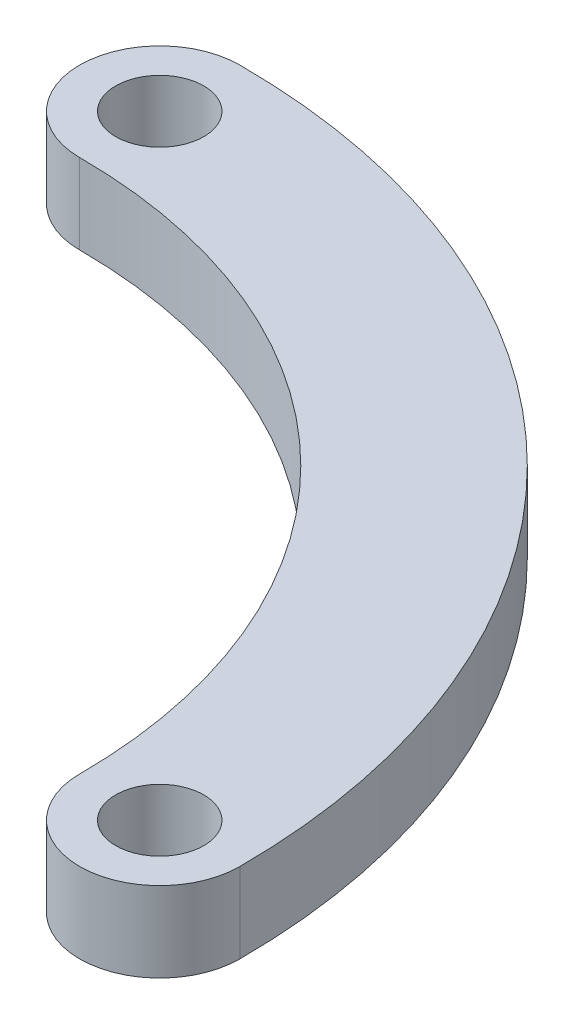
from build123d import *

# Parameters (mm, degrees)
SKETCH_1_R      = 1.65
EXTRUDE_2_DEPTH = 3


with BuildPart() as part:
    # 草图1 → 凸台-拉伸2 (new body)
    with BuildSketch(Plane(origin=(0, 0, 0), x_dir=(1, 0, 0), z_dir=(0, 1, 0))):
        with BuildLine():
            ThreePointArc((20, 0), (14.142135624, 14.142135624), (0, 20))
            ThreePointArc((0, 20), (-3, 23), (0, 26))
            ThreePointArc((0, 26), (18.384776311, 18.384776311), (26, 0))
            ThreePointArc((26, 0), (23, -3), (20, 0))
        make_face()
        with Locations(Location((0, 23, 0), (0, 0, 270))):
            Circle(SKETCH_1_R, mode=Mode.SUBTRACT)
        with Locations(Location((23, 0, 0), (0, 0, 270))):
            Circle(SKETCH_1_R, mode=Mode.SUBTRACT)
    extrude(amount=EXTRUDE_2_DEPTH)


solid = part.part
